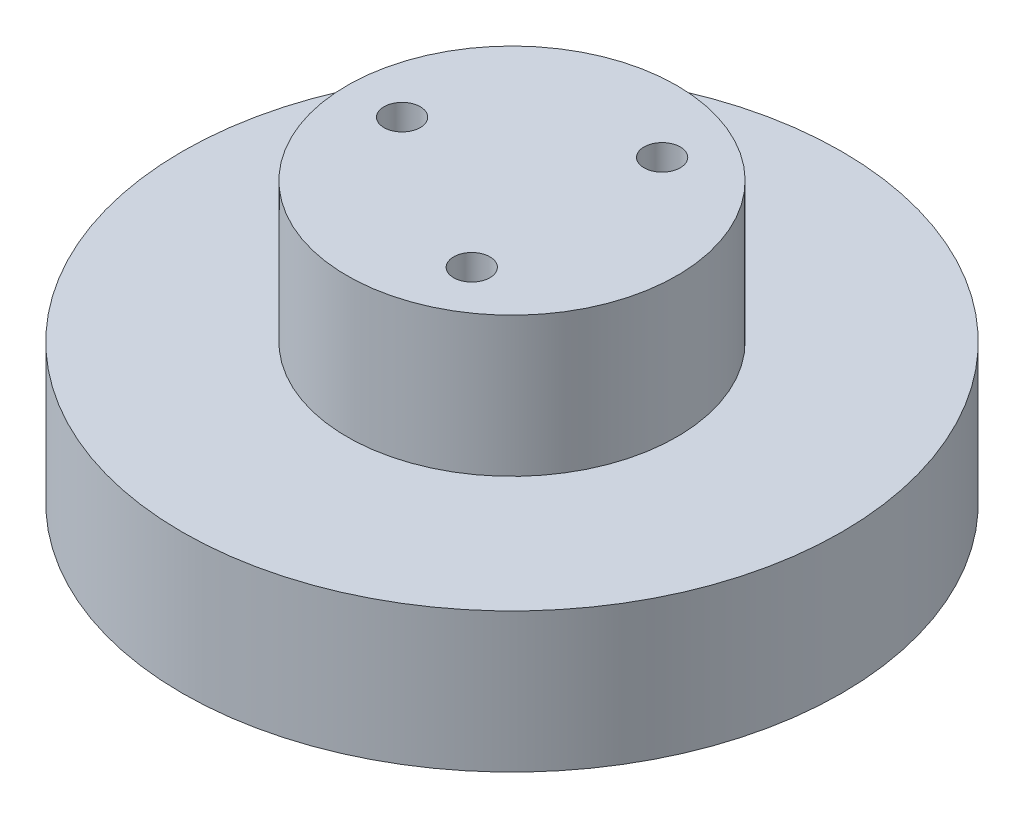
from build123d import *

# Parameters (mm, degrees)
M4X0_7_TAPPED_HOLE1_D     = 3.3
M4X0_7_TAPPED_HOLE1_DEPTH = 10.1
M4X0_7_TAPPED_HOLE1_TIP   = 0.991420021
M4X0_7_TAPPED_HOLE2_D     = 3.3
M4X0_7_TAPPED_HOLE2_DEPTH = 10.1
M4X0_7_TAPPED_HOLE2_TIP   = 0.991420021


with BuildPart() as part:
    # Sketch1 → Revolve1 (revolve)
    with BuildSketch(Plane.XY, mode=Mode.PRIVATE) as revolve1_sk:
        Polygon((0, 12.7), (-15, 12.7), (-15, 0), (-30, 0), (-30, -12.7), (0, -12.7), align=None)
    revolve(revolve1_sk.sketch.rotate(Axis((0, -12.7, 0), (0, 1, 0)), 270), axis=Axis((0, -12.7, 0), (0, 1, 0)))

    # M4x0.7 Tapped Hole1
    with Locations(Plane(origin=(0, 12.7, 0), x_dir=(1, 0, 0), z_dir=(0, 1, 0))):
        with Locations((-10, 0), (5, 8.660254038), (5, -8.660254038)):
            Hole(M4X0_7_TAPPED_HOLE1_D / 2, depth=M4X0_7_TAPPED_HOLE1_DEPTH)
            with Locations((0, 0, -(M4X0_7_TAPPED_HOLE1_DEPTH + M4X0_7_TAPPED_HOLE1_TIP / 2))):  # 118° drill point
                Cone(0, M4X0_7_TAPPED_HOLE1_D / 2, M4X0_7_TAPPED_HOLE1_TIP, mode=Mode.SUBTRACT)

    # M4x0.7 Tapped Hole2
    with Locations(Plane(origin=(0, -12.7, 0), x_dir=(-1, 0, 0), z_dir=(0, -1, 0))):
        with Locations((-20, 0), (10, -17.320508076), (10, 17.320508076)):
            Hole(M4X0_7_TAPPED_HOLE2_D / 2, depth=M4X0_7_TAPPED_HOLE2_DEPTH)
            with Locations((0, 0, -(M4X0_7_TAPPED_HOLE2_DEPTH + M4X0_7_TAPPED_HOLE2_TIP / 2))):  # 118° drill point
                Cone(0, M4X0_7_TAPPED_HOLE2_D / 2, M4X0_7_TAPPED_HOLE2_TIP, mode=Mode.SUBTRACT)


solid = part.part
